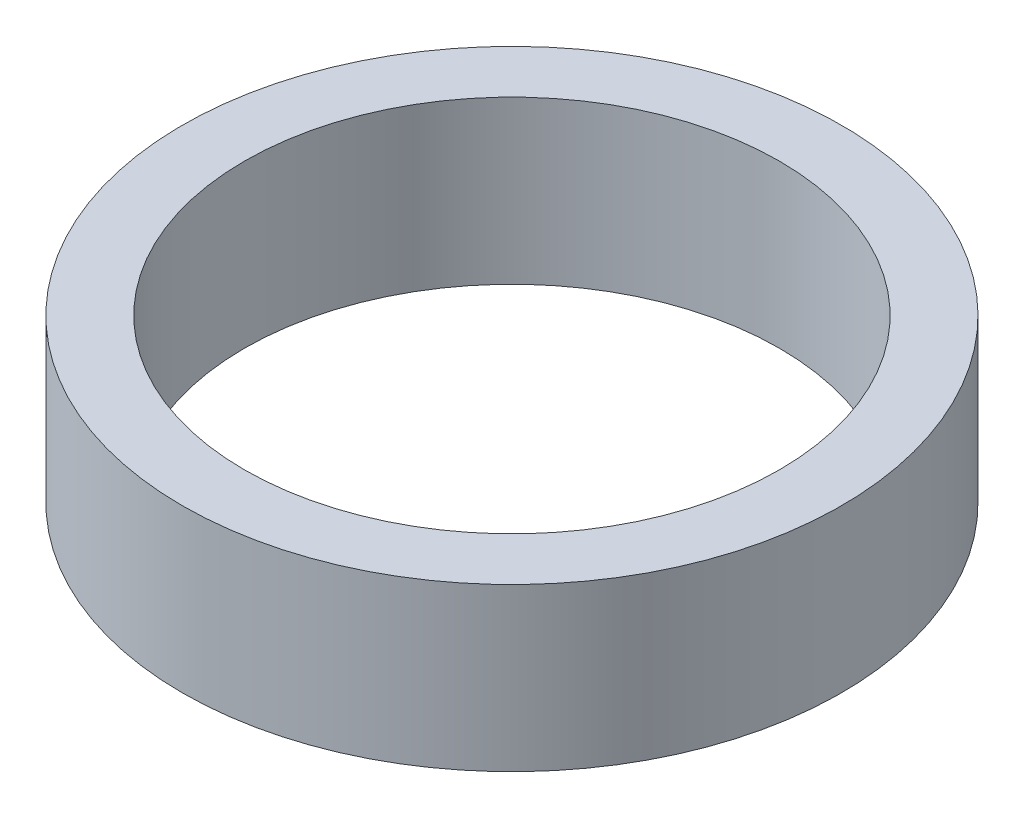
from build123d import *

# Parameters (mm, degrees)
ESQUISSE1_R   = 6.1
ESQUISSE1_R_2 = 4.95
SPACER_DEPTH  = 3


with BuildPart() as part:
    # Esquisse1 → Spacer (new body)
    with BuildSketch(Plane(origin=(0, 0, 0), x_dir=(1, 0, 0), z_dir=(0, 1, 0))):
        with Locations(Location((0, 0, 0), (0, 0, 270))):
            Circle(ESQUISSE1_R)
        with Locations(Location((0, 0, 0), (0, 0, 270))):
            Circle(ESQUISSE1_R_2, mode=Mode.SUBTRACT)
    extrude(amount=SPACER_DEPTH)


solid = part.part
